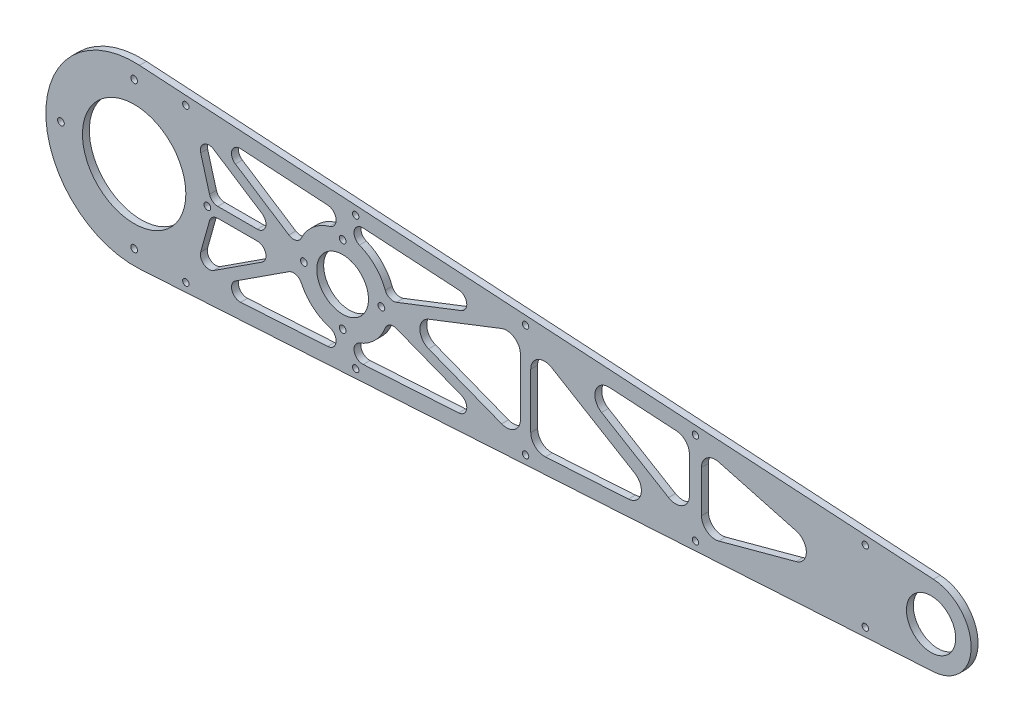
from build123d import *

# Parameters (mm, degrees)
SKETCH1_R              = 14.2875
SKETCH1_R_2            = 30
SKETCH1_R_3            = 15
SKETCH1_R_4            = 1.85
BOSS_EXTRUDE1_DEPTH    = 4
M3_5_CLEARANCE_HOLE1_D = 3.9
CUT_EXTRUDE1_DEPTH     = 10


with BuildPart() as part:
    # Sketch1 → Boss-Extrude1 (new body)
    with BuildSketch(Plane.XY):
        with BuildLine():
            Line((-228.151452703, 51.156245998), (232.657949662, 23.244899096))
            ThreePointArc((232.657949662, 23.244899096), (254.5375, 0), (232.657949662, -23.244899096))
            Line((232.657949662, -23.244899096), (-228.151452703, -51.156245998))
            ThreePointArc((-228.151452703, -51.156245998), (-282.5, 0), (-228.151452703, 51.156245998))
        make_face()
        with Locations((231.25, 0)):
            Circle(SKETCH1_R, mode=Mode.SUBTRACT)
        with Locations((-231.25, 0)):
            Circle(SKETCH1_R_2, mode=Mode.SUBTRACT)
        with Locations((-110.25, 0)):
            Circle(SKETCH1_R_3, mode=Mode.SUBTRACT)
        with Locations((-201.25, 44.517654426)):
            Circle(SKETCH1_R_4, mode=Mode.SUBTRACT)
        with Locations((-102.663346073, 38.546234825)):
            Circle(SKETCH1_R_4, mode=Mode.SUBTRACT)
        with Locations((-4.076692145, 32.574815224)):
            Circle(SKETCH1_R_4, mode=Mode.SUBTRACT)
        with Locations((94.509961782, 26.603395622)):
            Circle(SKETCH1_R_4, mode=Mode.SUBTRACT)
        with Locations((193.096615709, 20.631976021)):
            Circle(SKETCH1_R_4, mode=Mode.SUBTRACT)
        with Locations(Location((193.096615709, -20.631976021, 0), (0, 0, 180))):
            Circle(SKETCH1_R_4, mode=Mode.SUBTRACT)
        with Locations(Location((94.509961782, -26.603395622, 0), (0, 0, 180))):
            Circle(SKETCH1_R_4, mode=Mode.SUBTRACT)
        with Locations(Location((-4.076692145, -32.574815224, 0), (0, 0, 180))):
            Circle(SKETCH1_R_4, mode=Mode.SUBTRACT)
        with Locations(Location((-102.663346073, -38.546234825, 0), (0, 0, 180))):
            Circle(SKETCH1_R_4, mode=Mode.SUBTRACT)
        with Locations(Location((-201.25, -44.517654426, 0), (0, 0, 180))):
            Circle(SKETCH1_R_4, mode=Mode.SUBTRACT)
    extrude(amount=BOSS_EXTRUDE1_DEPTH)

    # M3.5 Clearance Hole1 (through all)
    with Locations(Plane.XY.offset(4)):
        with Locations((-231.25, 42.5), (-188.75, 0), (-132.75, 0), (-110.25, 22.5), (-87.75, 0), (-110.25, -22.5), (-273.75, 0), (-231.25, -42.5)):
            Hole(M3_5_CLEARANCE_HOLE1_D / 2)

    # Sketch7 → Cut-Extrude1 (cut)
    with BuildSketch(Plane.XY.offset(4)):
        with BuildLine():
            Line((108.094193191, 19.830412487), (152.959047941, 7.723728338))
            ThreePointArc((152.959047941, 7.723728338), (158.874816531, 0), (152.959047941, -7.723728338))
            Line((152.959047941, -7.723728338), (108.094193191, -19.830412487))
            ThreePointArc((108.094193191, -19.830412487), (101.145491167, -18.457819925), (98.009961782, -12.106684149))
            Line((98.009961782, -12.106684149), (98.009961782, 12.106684149))
            ThreePointArc((98.009961782, 12.106684149), (101.145491167, 18.457819925), (108.094193191, 19.830412487))
        make_face()
        with BuildLine():
            Line((91.009961782, -5.704410534), (91.009961782, 15.277961264))
            ThreePointArc((91.009961782, 15.277961264), (88.835311789, 20.761144399), (83.493637458, 23.263326493))
            Line((83.493637458, 23.263326493), (44.615483399, 25.618186527))
            ThreePointArc((44.615483399, 25.618186527), (36.490430728, 20.001229544), (40.014500476, 10.773682793))
            Line((40.014500476, 10.773682793), (78.892654535, -12.563549039))
            ThreePointArc((78.892654535, -12.563549039), (86.950871704, -12.666395092), (91.009961782, -5.704410534))
        make_face()
        with BuildLine():
            Line((11.040615102, 18.835101612), (59.256061992, -10.106989112))
            ThreePointArc((59.256061992, -10.106989112), (62.909345697, -18.868209702), (55.62243042, -24.951492846))
            Line((55.62243042, -24.951492846), (7.40698353, -27.871915166))
            ThreePointArc((7.40698353, -27.871915166), (1.440124719, -25.711899944), (-1.076692145, -19.886549937))
            Line((-1.076692145, -19.886549937), (-1.076692145, 11.975963107))
            ThreePointArc((-1.076692145, 11.975963107), (2.982397933, 18.937947665), (11.040615102, 18.835101612))
        make_face()
        with BuildLine():
            Line((-7.076692145, -16.488216766), (-7.076692145, 16.488216766))
            ThreePointArc((-7.076692145, 16.488216766), (-10.56107203, 23.091941092), (-17.978985888, 23.943194367))
            Line((-17.978985888, 23.943194367), (-60.331448304, 7.454977601))
            ThreePointArc((-60.331448304, 7.454977601), (-65.429154561, 0), (-60.331448304, -7.454977601))
            Line((-60.331448304, -7.454977601), (-17.978985888, -23.943194367))
            ThreePointArc((-17.978985888, -23.943194367), (-10.56107203, -23.091941092), (-7.076692145, -16.488216766))
        make_face()
        with BuildLine():
            Line((-79.023457852, 6.616651493), (-41.387349534, 21.268746715))
            ThreePointArc((-41.387349534, 21.268746715), (-38.261519247, 26.701886011), (-42.898985826, 30.918960984))
            Line((-42.898985826, 30.918960984), (-98.34861526, 34.277559647))
            ThreePointArc((-98.34861526, 34.277559647), (-103.531708107, 30.371987358), (-100.492037548, 24.638022826))
            ThreePointArc((-100.492037548, 24.638022826), (-91.408821848, 18.634913625), (-85.506059466, 9.486169241))
            ThreePointArc((-85.506059466, 9.486169241), (-82.861226958, 6.703913435), (-79.023457852, 6.616651493))
        make_face()
        with BuildLine():
            Line((-172.485050673, 29.401404781), (-141.465979865, 9.242335075))
            ThreePointArc((-141.465979865, 9.242335075), (-137.374294793, 8.625273291), (-134.218916995, 11.302257212))
            ThreePointArc((-134.218916995, 11.302257212), (-127.488882583, 20.126373923), (-117.7355471, 25.420790401))
            ThreePointArc((-117.7355471, 25.420790401), (-114.065979457, 30.952175342), (-118.881140508, 35.52122011))
            Line((-118.881140508, 35.52122011), (-169.458127675, 38.584681548))
            ThreePointArc((-169.458127675, 38.584681548), (-174.509115504, 35.159056133), (-172.485050673, 29.401404781))
        make_face()
        with BuildLine():
            Line((-192.622687213, 24.889664687), (-187.500750367, 6.648335526))
            ThreePointArc((-187.500750367, 6.648335526), (-185.706988459, 4.01513348), (-182.686915809, 3))
            Line((-182.686915809, 3), (-159.740638738, 3))
            ThreePointArc((-159.740638738, 3), (-154.946782383, 6.579105474), (-157.016013037, 12.192423498))
            Line((-157.016013037, 12.192423498), (-185.084226954, 30.43375266))
            ThreePointArc((-185.084226954, 30.43375266), (-190.771187254, 30.269303059), (-192.622687213, 24.889664687))
        make_face()
        with BuildLine():
            Line((-118.881140508, -35.52122011), (-169.458127675, -38.584681548))
            ThreePointArc((-169.458127675, -38.584681548), (-174.509115504, -35.159056133), (-172.485050673, -29.401404781))
            Line((-172.485050673, -29.401404781), (-141.465979865, -9.242335075))
            ThreePointArc((-141.465979865, -9.242335075), (-137.374294793, -8.625273291), (-134.218916995, -11.302257212))
            ThreePointArc((-134.218916995, -11.302257212), (-127.488882583, -20.126373923), (-117.7355471, -25.420790401))
            ThreePointArc((-117.7355471, -25.420790401), (-114.065979457, -30.952175342), (-118.881140508, -35.52122011))
        make_face()
        with BuildLine():
            Line((-157.016013037, -12.192423498), (-185.084226954, -30.43375266))
            ThreePointArc((-185.084226954, -30.43375266), (-190.771187254, -30.269303059), (-192.622687213, -24.889664687))
            Line((-192.622687213, -24.889664687), (-187.500750367, -6.648335526))
            ThreePointArc((-187.500750367, -6.648335526), (-185.706988459, -4.01513348), (-182.686915809, -3))
            Line((-182.686915809, -3), (-159.740638738, -3))
            ThreePointArc((-159.740638738, -3), (-154.946782383, -6.579105474), (-157.016013037, -12.192423498))
        make_face()
        with BuildLine():
            Line((-42.898985826, -30.918960984), (-98.34861526, -34.277559647))
            ThreePointArc((-98.34861526, -34.277559647), (-103.531708107, -30.371987358), (-100.492037548, -24.638022826))
            ThreePointArc((-100.492037548, -24.638022826), (-91.408821848, -18.634913625), (-85.506059466, -9.486169241))
            ThreePointArc((-85.506059466, -9.486169241), (-82.861226958, -6.703913435), (-79.023457852, -6.616651493))
            Line((-79.023457852, -6.616651493), (-41.387349534, -21.268746715))
            ThreePointArc((-41.387349534, -21.268746715), (-38.261519247, -26.701886011), (-42.898985826, -30.918960984))
        make_face()
    extrude(amount=-CUT_EXTRUDE1_DEPTH, mode=Mode.SUBTRACT)


solid = part.part
